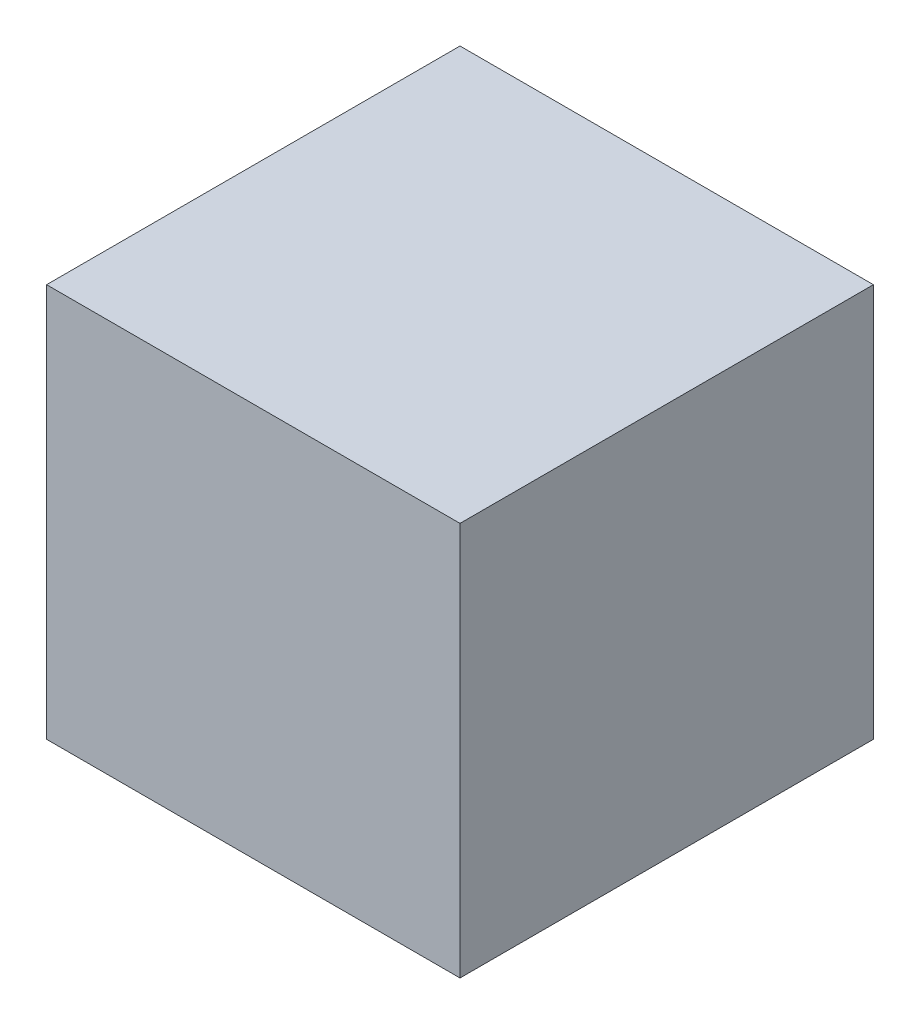
from build123d import *

# Parameters (mm, degrees)
SKETCH1_W           = 42
SKETCH1_H           = 42
BOSS_EXTRUDE1_DEPTH = 40


with BuildPart() as part:
    # Sketch1 → Boss-Extrude1 (new body)
    with BuildSketch(Plane(origin=(0, 0, 0), x_dir=(1, 0, 0), z_dir=(0, 1, 0))):
        with Locations((21, 21)):
            Rectangle(SKETCH1_W, SKETCH1_H)
    extrude(amount=BOSS_EXTRUDE1_DEPTH)


solid = part.part
